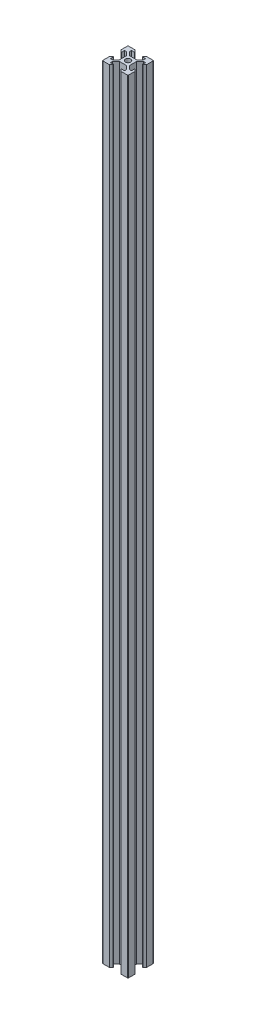
from build123d import *

# Parameters (mm, degrees)
SKETCH2_R              = 2.074585303
VSLOT2020_2020_5_DEPTH = 609.6


with BuildPart() as part:
    # Sketch2 → Vslot2020 2020(5) (new body)
    with BuildSketch(Plane.ZX):
        with BuildLine():
            Line((13.9, 7.149086807), (13.9, 12.844511469))
            Line((13.9, 12.844511469), (16.558493656, 15.492177728))
            Line((16.558493656, 15.492177728), (16.550703242, 15.5))
            Line((16.550703242, 15.5), (18.2, 15.5))
            Line((18.2, 15.5), (18.2, 13.12))
            Line((18.2, 13.12), (18.534428266, 13.12))
            Line((18.534428266, 13.12), (20, 14.58))
            Line((20, 14.58), (20, 19.5))
            ThreePointArc((20, 19.5), (19.853553391, 19.853553391), (19.5, 20))
            Line((19.5, 20), (14.575, 20))
            Line((14.575, 20), (13.12, 18.545))
            Line((13.12, 18.545), (13.12, 18.2))
            Line((13.12, 18.2), (15.5, 18.2))
            Line((15.5, 18.2), (15.5, 16.555))
            Line((15.5, 16.555), (12.834142613, 13.9))
            Line((12.834142613, 13.9), (7.155, 13.9))
            Line((7.155, 13.9), (4.5, 16.555))
            Line((4.5, 16.555), (4.5, 18.2))
            Line((4.5, 18.2), (6.875, 18.2))
            Line((6.875, 18.2), (6.875, 18.545))
            Line((6.875, 18.545), (5.42, 20))
            Line((5.42, 20), (0.5, 20))
            ThreePointArc((0.5, 20), (0.146446609, 19.853553391), (0, 19.5))
            Line((0, 19.5), (0, 14.58))
            Line((0, 14.58), (1.46, 13.12))
            Line((1.46, 13.12), (1.8, 13.12))
            Line((1.8, 13.12), (1.8, 15.5))
            Line((1.8, 15.5), (3.445, 15.5))
            Line((3.445, 15.5), (3.439339828, 15.494339828))
            Line((3.439339828, 15.494339828), (6.094339828, 12.839339828))
            Line((6.094339828, 12.839339828), (6.1, 12.845))
            Line((6.1, 12.845), (6.1, 7.149086807))
            Line((6.1, 7.149086807), (3.439339828, 4.5))
            Line((3.439339828, 4.5), (1.8, 4.5))
            Line((1.8, 4.5), (1.8, 6.88))
            Line((1.8, 6.88), (1.46, 6.88))
            Line((1.46, 6.88), (0, 5.42))
            Line((0, 5.42), (0, 0.5))
            ThreePointArc((0, 0.5), (0.146446609, 0.146446609), (0.5, 0))
            Line((0.5, 0), (5.42, 0))
            Line((5.42, 0), (6.875, 1.455))
            Line((6.875, 1.455), (6.875, 1.8))
            Line((6.875, 1.8), (4.5, 1.8))
            Line((4.5, 1.8), (4.5, 3.4393348))
            Line((4.5, 3.4393348), (7.158345795, 6.086117297))
            Line((7.158345795, 6.086117297), (7.144523479, 6.1))
            Line((7.144523479, 6.1), (12.854625295, 6.1))
            Line((12.854625295, 6.1), (12.841221344, 6.086548451))
            Line((12.841221344, 6.086548451), (15.499715, 3.437461644))
            Line((15.499715, 3.437461644), (15.5, 1.8))
            Line((15.5, 1.8), (13.12, 1.8))
            Line((13.12, 1.8), (13.12, 1.455))
            Line((13.12, 1.455), (14.575, 0))
            Line((14.575, 0), (19.5, 0))
            ThreePointArc((19.5, 0), (19.853553391, 0.146446609), (20, 0.5))
            Line((20, 0.5), (20, 5.42))
            Line((20, 5.42), (18.606904708, 6.88))
            Line((18.606904708, 6.88), (18.2, 6.88))
            Line((18.2, 6.88), (18.2, 4.5))
            Line((18.2, 4.5), (16.558493656, 4.5))
            Line((16.558493656, 4.5), (13.9, 7.149086807))
        make_face()
        with Locations((10, 10)):
            Circle(SKETCH2_R, mode=Mode.SUBTRACT)
    extrude(amount=VSLOT2020_2020_5_DEPTH)


solid = part.part
